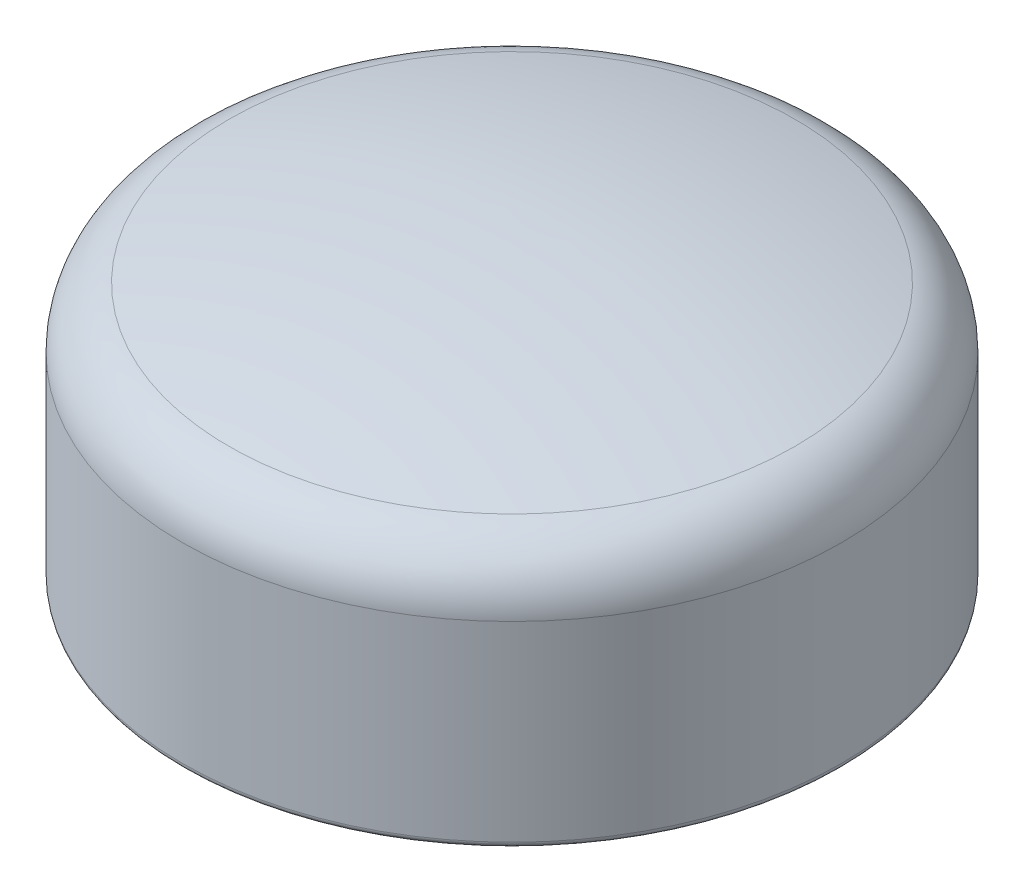
from build123d import *

# Parameters (mm, degrees)
FILLET1_R = 0.25


with BuildPart() as part:
    # Sketch1 → Revolve1 (revolve)
    with BuildSketch(Plane.XY):
        with BuildLine():
            Line((13.5, 8.080985965), (13.5, 0))
            Line((13.5, 0), (12.5, 0))
            Line((12.5, 0), (12.5, 8.080985965))
            ThreePointArc((12.5, 8.080985965), (12.177697445, 9.030458674), (11.343995274, 9.587520655))
            ThreePointArc((11.343995274, 9.587520655), (5.720941081, 10.706015676), (0, 11.080985965))
            Line((0, 11.080985965), (0, 12.080985965))
            ThreePointArc((0, 12.080985965), (5.851467273, 11.697460538), (11.60281432, 10.553446481))
            ThreePointArc((11.60281432, 10.553446481), (12.971050786, 9.639220103), (13.5, 8.080985965))
        make_face()
    revolve(axis=Axis((0, -281.832551031, 0), (0, 1, 0)))

    # Fillet1
    fillet1_edges = [part.edges().sort_by_distance(p)[0] for p in [
        (-13.5, 0, 0),
        (-12.5, 0, 0),
    ]]
    fillet(fillet1_edges, radius=FILLET1_R)


solid = part.part
